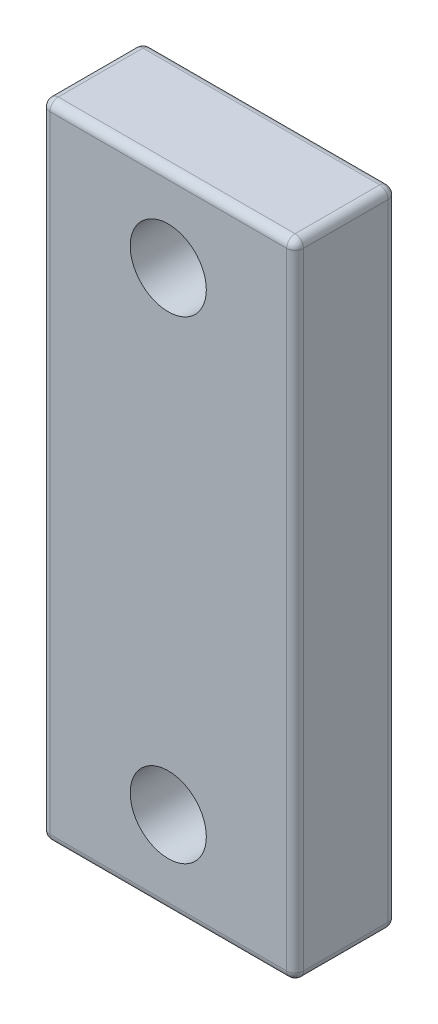
from build123d import *

# Parameters (mm, degrees)
SKETCH_1_W             = 15
SKETCH_1_H             = 38
SKETCH_1_R             = 2.25
EXTRUDE_1_DEPTH        = 3
FILLET_1_R             = 0.5
CUT_EXTRUDE_1_DEPTH    = 10.5
PATTERN_LINEAR_1_COUNT = 3
PATTERN_LINEAR_1_PITCH = 4.5


with BuildPart() as part:
    # 草图1 → 凸台-拉伸1 (new, symmetric)
    with BuildSketch(Plane.XY):
        Rectangle(SKETCH_1_W, SKETCH_1_H)
        with Locations((0, 14)):
            Circle(SKETCH_1_R, mode=Mode.SUBTRACT)
        with Locations((0, -14)):
            Circle(SKETCH_1_R, mode=Mode.SUBTRACT)
    extrude(amount=EXTRUDE_1_DEPTH, both=True)

    # 圆角1
    fillet_1_edges = [part.edges().sort_by_distance(p)[0] for p in [
        (-7.5, 0, 3),
        (0, -19, 3),
        (7.5, 0, 3),
        (0, -19, -3),
        (-7.5, 0, -3),
        (0, 19, -3),
        (7.5, 0, -3),
        (7.5, -19, 0),
        (-7.5, -19, 0),
        (-7.5, 19, 0),
        (7.5, 19, 0),
        (0, 19, 3),
    ]]
    fillet(fillet_1_edges, radius=FILLET_1_R)

    # 草图2 → 切除-拉伸1 (cut, symmetric)
    with BuildSketch(Plane(origin=(0, 0, 0), x_dir=(1, 0, 0), z_dir=(0, 1, 0))):
        Polygon((-7, 3), (-4.5, 2), (-2, 3), align=None)
    cut_extrude_1 = extrude(amount=CUT_EXTRUDE_1_DEPTH, both=True, mode=Mode.SUBTRACT)

    # 阵列(线性)1: 切除-拉伸1 ×3
    with Locations(*[(i * PATTERN_LINEAR_1_PITCH, 0, 0) for i in range(1, PATTERN_LINEAR_1_COUNT)]):
        add(cut_extrude_1, mode=Mode.SUBTRACT)


solid = part.part
